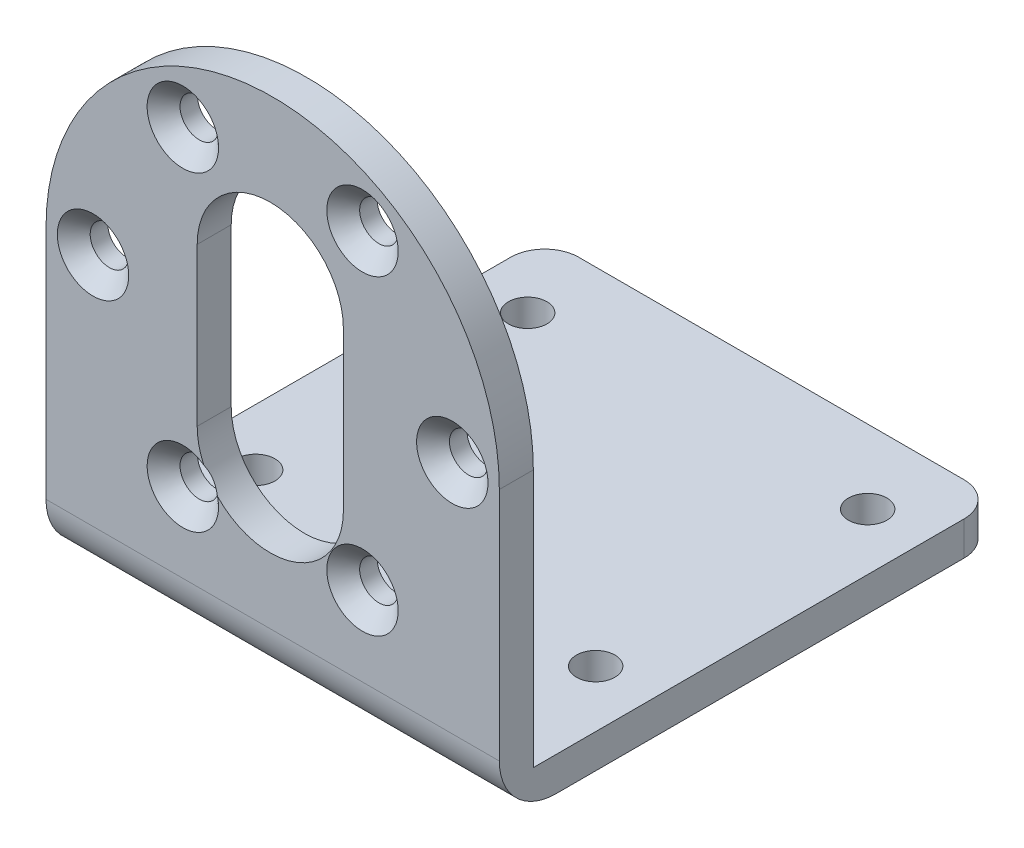
from build123d import *

# Parameters (mm, degrees)
BOSS_EXTRUDE1_DEPTH                            = 3
CSK_FOR_M3_FLAT_HEAD_MACHINE_SCREW1_AT_2_COUNT = 2
CSK_FOR_M3_FLAT_HEAD_MACHINE_SCREW1_AT_2_PITCH = 15.85
CSK_FOR_M3_FLAT_HEAD_MACHINE_SCREW1_AT_3_COUNT = 2
CSK_FOR_M3_FLAT_HEAD_MACHINE_SCREW1_AT_3_PITCH = 27.4530053
CSK_FOR_M3_FLAT_HEAD_MACHINE_SCREW1_AT_4_COUNT = 2
CSK_FOR_M3_FLAT_HEAD_MACHINE_SCREW1_AT_4_PITCH = 31.7
CSK_FOR_M3_FLAT_HEAD_MACHINE_SCREW1_AT_5_COUNT = 2
CSK_FOR_M3_FLAT_HEAD_MACHINE_SCREW1_AT_5_PITCH = 27.4530053
CSK_FOR_M3_FLAT_HEAD_MACHINE_SCREW1_AT_6_COUNT = 2
CSK_FOR_M3_FLAT_HEAD_MACHINE_SCREW1_AT_6_PITCH = 15.85
SKETCH6_W                                      = 40
SKETCH6_H                                      = 3
BOSS_EXTRUDE2_DEPTH                            = 41
SKETCH7_R                                      = 1.7
CUT_EXTRUDE1_DEPTH                             = 3
FILLET1_R                                      = 3
FILLET2_R                                      = 5


with BuildPart() as part:
    # Sketch2 → Boss-Extrude1 (new body)
    with BuildSketch(Plane.XY):
        with BuildLine():
            Line((0, 0), (40, 0))
            Line((40, 0), (40, 25.75))
            ThreePointArc((40, 25.75), (20, 45.75), (0, 25.75))
            Line((0, 25.75), (0, 0))
        make_face()
        with BuildLine():
            Line((26.240819183, 17.25), (26.240819183, 31.15))
            ThreePointArc((26.240819183, 31.15), (19.790819183, 37.6), (13.340819183, 31.15))
            Line((13.340819183, 31.15), (13.340819183, 17.25))
            ThreePointArc((13.340819183, 17.25), (19.790819183, 10.8), (26.240819183, 17.25))
        make_face(mode=Mode.SUBTRACT)
    extrude(amount=-BOSS_EXTRUDE1_DEPTH)

    # Sketch4 → CSK for M3 Flat Head Machine Screw1 (revolve, cut)
    with BuildSketch(Plane(origin=(4.15, 25.75, 0), x_dir=(0, -1, 0), z_dir=(1, 0, 0))):
        Polygon((0, 0), (0, 3), (1.7, 3), (1.7, 1.45), (3.15, 0), align=None)
    csk_for_m3_flat_head_machine_screw1 = revolve(axis=Axis((4.15, 25.75, 6.35), (0, 0, -1)), mode=Mode.SUBTRACT)

    # CSK for M3 Flat Head Machine Screw1 at 2: CSK for M3 Flat Head Machine Screw1 ×2
    with Locations(*[Vector(0.49999999999999317, 0.8660254037844426, 0) * (i * CSK_FOR_M3_FLAT_HEAD_MACHINE_SCREW1_AT_2_PITCH) for i in range(1, CSK_FOR_M3_FLAT_HEAD_MACHINE_SCREW1_AT_2_COUNT)]):
        add(csk_for_m3_flat_head_machine_screw1, mode=Mode.SUBTRACT)

    # CSK for M3 Flat Head Machine Screw1 at 3: CSK for M3 Flat Head Machine Screw1 ×2
    with Locations(*[Vector(0.8660254037844348, 0.5000000000000067, 0) * (i * CSK_FOR_M3_FLAT_HEAD_MACHINE_SCREW1_AT_3_PITCH) for i in range(1, CSK_FOR_M3_FLAT_HEAD_MACHINE_SCREW1_AT_3_COUNT)]):
        add(csk_for_m3_flat_head_machine_screw1, mode=Mode.SUBTRACT)

    # CSK for M3 Flat Head Machine Screw1 at 4: CSK for M3 Flat Head Machine Screw1 ×2
    with Locations(*[(i * CSK_FOR_M3_FLAT_HEAD_MACHINE_SCREW1_AT_4_PITCH, 0, 0) for i in range(1, CSK_FOR_M3_FLAT_HEAD_MACHINE_SCREW1_AT_4_COUNT)]):
        add(csk_for_m3_flat_head_machine_screw1, mode=Mode.SUBTRACT)

    # CSK for M3 Flat Head Machine Screw1 at 5: CSK for M3 Flat Head Machine Screw1 ×2
    with Locations(*[Vector(0.8660254037844427, -0.49999999999999306, 0) * (i * CSK_FOR_M3_FLAT_HEAD_MACHINE_SCREW1_AT_5_PITCH) for i in range(1, CSK_FOR_M3_FLAT_HEAD_MACHINE_SCREW1_AT_5_COUNT)]):
        add(csk_for_m3_flat_head_machine_screw1, mode=Mode.SUBTRACT)

    # CSK for M3 Flat Head Machine Screw1 at 6: CSK for M3 Flat Head Machine Screw1 ×2
    with Locations(*[Vector(0.5000000000000067, -0.8660254037844349, 0) * (i * CSK_FOR_M3_FLAT_HEAD_MACHINE_SCREW1_AT_6_PITCH) for i in range(1, CSK_FOR_M3_FLAT_HEAD_MACHINE_SCREW1_AT_6_COUNT)]):
        add(csk_for_m3_flat_head_machine_screw1, mode=Mode.SUBTRACT)

    # Sketch6 → Boss-Extrude2 (add)
    with BuildSketch(Plane(origin=(0, 0, -3), x_dir=(-1, 0, 0), z_dir=(0, 0, -1))):
        with Locations((-20, 1.5)):
            Rectangle(SKETCH6_W, SKETCH6_H)
    extrude(amount=BOSS_EXTRUDE2_DEPTH)

    # Sketch7 → Cut-Extrude1 (cut)
    with BuildSketch(Plane.XZ):
        with Locations(Location((5, -37.5, 0), (0, 0, 270))):
            Circle(SKETCH7_R)
        with Locations(Location((5, -13.5, 0), (0, 0, 270))):
            Circle(SKETCH7_R)
        with Locations(Location((35, -37.5, 0), (0, 0, 270))):
            Circle(SKETCH7_R)
        with Locations(Location((35, -13.5, 0), (0, 0, 270))):
            Circle(SKETCH7_R)
    extrude(amount=-CUT_EXTRUDE1_DEPTH, mode=Mode.SUBTRACT)

    # Fillet1
    fillet1_edges = [part.edges().sort_by_distance(p)[0] for p in [
        (0, 1.5, -44),
        (40, 1.5, -44),
    ]]
    fillet(fillet1_edges, radius=FILLET1_R)

    # Fillet2
    fillet2_edges = [part.edges().sort_by_distance(p)[0] for p in [
        (20, 0, 0),
    ]]
    fillet(fillet2_edges, radius=FILLET2_R)


solid = part.part
